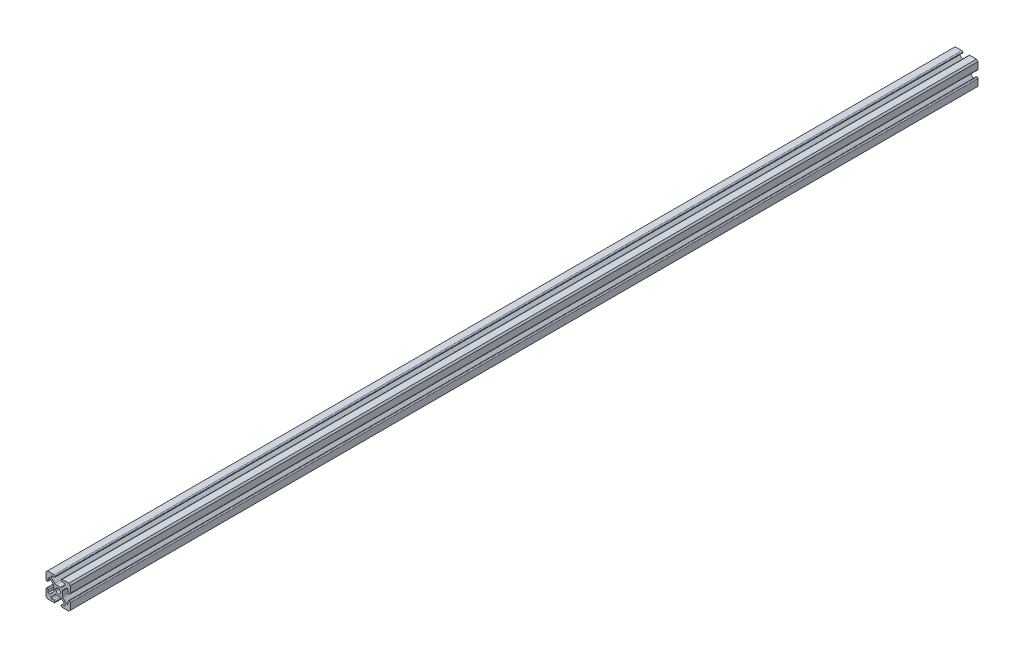
from build123d import *

# Parameters (mm, degrees)
BOSS_EXTRUDE1_DEPTH = 950


with BuildPart() as part:
    # Sketch1 → Boss-Extrude1 (new body)
    with BuildSketch(Plane.XY):
        with BuildLine():
            Line((-11.199951579, -12.7), (-4.222256762, -12.7))
            ThreePointArc((-4.222256762, -12.7), (-3.503836272, -12.40242049), (-3.206256762, -11.684))
            Line((-3.206256762, -11.684), (-3.206256762, -11.440665395))
            ThreePointArc((-3.206256762, -11.440665395), (-3.503836272, -10.722244905), (-4.222256762, -10.424665395))
            Line((-4.222256762, -10.424665395), (-6.40926672, -10.424665395))
            ThreePointArc((-6.40926672, -10.424665395), (-7.347928334, -9.797471742), (-7.127687178, -8.690244874))
            Line((-7.127687178, -8.690244874), (-3.593166694, -5.155724698))
            ThreePointArc((-3.593166694, -5.155724698), (-2.876257435, -4.67670128), (-2.030605322, -4.508490626))
            Line((-2.030605322, -4.508490626), (2.030598864, -4.508490626))
            ThreePointArc((2.030598864, -4.508490626), (2.876251031, -4.676701303), (3.593160319, -5.155724782))
            Line((3.593160319, -5.155724782), (7.127680379, -8.690244912))
            ThreePointArc((7.127680379, -8.690244912), (7.347921489, -9.019859032), (7.425259882, -9.408665395))
            ThreePointArc((7.425259882, -9.408665395), (7.127680372, -10.127085884), (6.409259882, -10.424665395))
            Line((6.409259882, -10.424665395), (4.22225065, -10.424665395))
            ThreePointArc((4.22225065, -10.424665395), (3.50383016, -10.722244905), (3.20625065, -11.440665395))
            Line((3.20625065, -11.440665395), (3.20625065, -11.684))
            ThreePointArc((3.20625065, -11.684), (3.50383016, -12.40242049), (4.22225065, -12.7))
            Line((4.22225065, -12.7), (11.199952422, -12.7))
            Line((11.199952422, -12.7), (12.7, -11.199951732))
            Line((12.7, -11.199951732), (12.7, -4.222256762))
            ThreePointArc((12.7, -4.222256762), (12.40242049, -3.503836272), (11.684, -3.206256762))
            Line((11.684, -3.206256762), (11.440665395, -3.206256762))
            ThreePointArc((11.440665395, -3.206256762), (10.722244905, -3.503836272), (10.424665395, -4.222256762))
            Line((10.424665395, -4.222256762), (10.424665395, -6.40926672))
            ThreePointArc((10.424665395, -6.40926672), (9.797471742, -7.347928334), (8.690244874, -7.127687178))
            Line((8.690244874, -7.127687178), (5.155724698, -3.593166694))
            ThreePointArc((5.155724698, -3.593166694), (4.67670128, -2.876257435), (4.508490626, -2.030605322))
            Line((4.508490626, -2.030605322), (4.508490626, 2.030598864))
            ThreePointArc((4.508490626, 2.030598864), (4.676701303, 2.876251031), (5.155724782, 3.593160319))
            Line((5.155724782, 3.593160319), (8.690244912, 7.127680379))
            ThreePointArc((8.690244912, 7.127680379), (9.019859032, 7.347921489), (9.408665395, 7.425259882))
            ThreePointArc((9.408665395, 7.425259882), (10.127085884, 7.127680372), (10.424665395, 6.409259882))
            Line((10.424665395, 6.409259882), (10.424665395, 4.22225065))
            ThreePointArc((10.424665395, 4.22225065), (10.722244905, 3.50383016), (11.440665395, 3.20625065))
            Line((11.440665395, 3.20625065), (11.684, 3.20625065))
            ThreePointArc((11.684, 3.20625065), (12.40242049, 3.50383016), (12.7, 4.22225065))
            Line((12.7, 4.22225065), (12.7, 11.199954756))
            Line((12.7, 11.199954756), (11.199954423, 12.7))
            Line((11.199954423, 12.7), (4.222256762, 12.7))
            ThreePointArc((4.222256762, 12.7), (3.503836272, 12.40242049), (3.206256762, 11.684))
            Line((3.206256762, 11.684), (3.206256762, 11.440665395))
            ThreePointArc((3.206256762, 11.440665395), (3.503836272, 10.722244905), (4.222256762, 10.424665395))
            Line((4.222256762, 10.424665395), (6.40926672, 10.424665395))
            ThreePointArc((6.40926672, 10.424665395), (7.347928334, 9.797471742), (7.127687178, 8.690244874))
            Line((7.127687178, 8.690244874), (3.593166694, 5.155724698))
            ThreePointArc((3.593166694, 5.155724698), (2.876257435, 4.67670128), (2.030605322, 4.508490626))
            Line((2.030605322, 4.508490626), (-2.030598864, 4.508490626))
            ThreePointArc((-2.030598864, 4.508490626), (-2.876251031, 4.676701303), (-3.593160319, 5.155724782))
            Line((-3.593160319, 5.155724782), (-7.127680379, 8.690244912))
            ThreePointArc((-7.127680379, 8.690244912), (-7.347921489, 9.019859032), (-7.425259882, 9.408665395))
            ThreePointArc((-7.425259882, 9.408665395), (-7.127680372, 10.127085884), (-6.409259882, 10.424665395))
            Line((-6.409259882, 10.424665395), (-4.22225065, 10.424665395))
            ThreePointArc((-4.22225065, 10.424665395), (-3.50383016, 10.722244905), (-3.20625065, 11.440665395))
            Line((-3.20625065, 11.440665395), (-3.20625065, 11.684))
            ThreePointArc((-3.20625065, 11.684), (-3.50383016, 12.40242049), (-4.22225065, 12.7))
            Line((-4.22225065, 12.7), (-11.199951733, 12.7))
            Line((-11.199951733, 12.7), (-12.7, 11.1999514))
            Line((-12.7, 11.1999514), (-12.7, 4.222256762))
            ThreePointArc((-12.7, 4.222256762), (-12.40242049, 3.503836272), (-11.684, 3.206256762))
            Line((-11.684, 3.206256762), (-11.440665395, 3.206256762))
            ThreePointArc((-11.440665395, 3.206256762), (-10.722244905, 3.503836272), (-10.424665395, 4.222256762))
            Line((-10.424665395, 4.222256762), (-10.424665395, 6.40926672))
            ThreePointArc((-10.424665395, 6.40926672), (-9.797471742, 7.347928334), (-8.690244874, 7.127687178))
            Line((-8.690244874, 7.127687178), (-5.155724698, 3.593166694))
            ThreePointArc((-5.155724698, 3.593166694), (-4.67670128, 2.876257435), (-4.508490626, 2.030605322))
            Line((-4.508490626, 2.030605322), (-4.508490626, -2.030598864))
            ThreePointArc((-4.508490626, -2.030598864), (-4.676701303, -2.876251031), (-5.155724782, -3.593160319))
            Line((-5.155724782, -3.593160319), (-8.690244912, -7.127680379))
            ThreePointArc((-8.690244912, -7.127680379), (-9.019859032, -7.347921489), (-9.408665395, -7.425259882))
            ThreePointArc((-9.408665395, -7.425259882), (-10.127085884, -7.127680372), (-10.424665395, -6.409259882))
            Line((-10.424665395, -6.409259882), (-10.424665395, -4.22225065))
            ThreePointArc((-10.424665395, -4.22225065), (-10.722244905, -3.50383016), (-11.440665395, -3.20625065))
            Line((-11.440665395, -3.20625065), (-11.684, -3.20625065))
            ThreePointArc((-11.684, -3.20625065), (-12.40242049, -3.50383016), (-12.7, -4.22225065))
            Line((-12.7, -4.22225065), (-12.7, -11.199952268))
            Line((-12.7, -11.199952268), (-11.199951579, -12.7))
        make_face()
        with BuildLine():
            ThreePointArc((-2.55499489, 0), (0, -2.55499489), (2.55499489, 0))
            ThreePointArc((2.55499489, 0), (0, 2.55499489), (-2.55499489, 0))
        make_face(mode=Mode.SUBTRACT)
    extrude(amount=BOSS_EXTRUDE1_DEPTH)


solid = part.part
